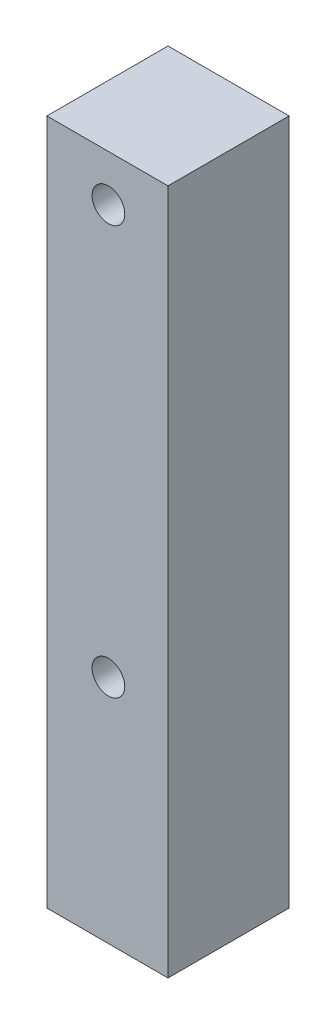
from build123d import *

# Parameters (mm, degrees)
SKETCH1_W           = 10
SKETCH1_H           = 10
BOSS_EXTRUDE1_DEPTH = 56.642
SKETCH3_R           = 1.35
CUT_EXTRUDE1_DEPTH  = 10
SKETCH4_R           = 1.35
CUT_EXTRUDE2_DEPTH  = 7
SKETCH8_R           = 1.48
CUT_EXTRUDE3_DEPTH  = 6


with BuildPart() as part:
    # Sketch1 → Boss-Extrude1 (new body)
    with BuildSketch(Plane(origin=(0, 0, 0), x_dir=(1, 0, 0), z_dir=(0, 1, 0))):
        with Locations((1.057692308, -0.576923077)):
            Rectangle(SKETCH1_W, SKETCH1_H)
    extrude(amount=BOSS_EXTRUDE1_DEPTH)

    # Sketch3 → Cut-Extrude1 (cut)
    with BuildSketch(Plane.XY.offset(5.576923077)):
        with Locations((1.137692308, 19.05)):
            Circle(SKETCH3_R)
        with Locations((1.137692308, 52.832)):
            Circle(SKETCH3_R)
    extrude(amount=-CUT_EXTRUDE1_DEPTH, mode=Mode.SUBTRACT)

    # Sketch4 → Cut-Extrude2 (cut)
    with BuildSketch(Plane.ZY.offset(3.942307692)):
        with Locations((0.576923077, 12.690710938)):
            Circle(SKETCH4_R)
        with Locations((0.576923077, 46.642)):
            Circle(SKETCH4_R)
    extrude(amount=-CUT_EXTRUDE2_DEPTH, mode=Mode.SUBTRACT)

    # Sketch8 → Cut-Extrude3 (cut)
    with BuildSketch(Plane(origin=(0, 0, 0), x_dir=(-1, 0, 0), z_dir=(0, -1, 0))):
        with Locations(Location((-0.977692308, -0.496923077, 0), (0, 0, 90))):
            Circle(SKETCH8_R)
    extrude(amount=-CUT_EXTRUDE3_DEPTH, mode=Mode.SUBTRACT)


solid = part.part
